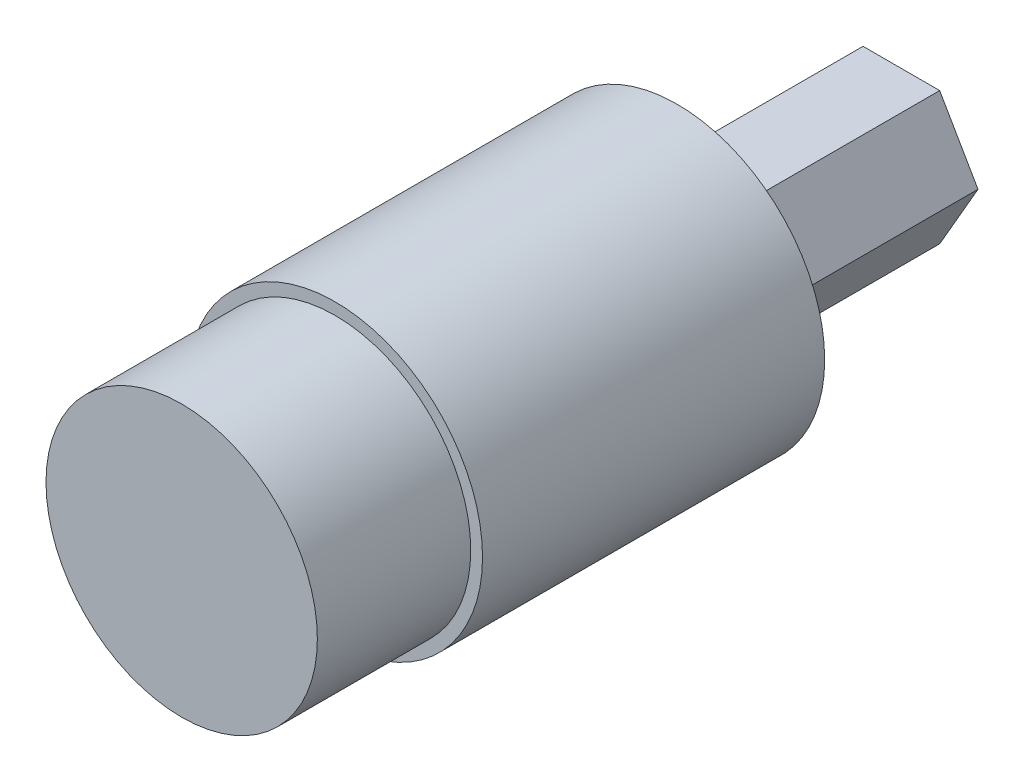
from build123d import *

# Parameters (mm, degrees)
SKETCH2_R           = 15.875
BOSS_EXTRUDE1_DEPTH = 53.34
SKETCH3_R           = 4.3053
BOSS_EXTRUDE2_DEPTH = 24.13
SKETCH4_R           = 3.175
BOSS_EXTRUDE3_DEPTH = 16.51
SKETCH5_OUTSIDE_W   = 51.704
SKETCH5_OUTSIDE_H   = 52.339
SKETCH5_OUTSIDE_R   = 14.605
CUT_EXTRUDE1_DEPTH  = 16.51


with BuildPart() as part:
    # Sketch2 → Boss-Extrude1 (new body)
    with BuildSketch(Plane.XY):
        Circle(SKETCH2_R)
    extrude(amount=BOSS_EXTRUDE1_DEPTH)

    # Sketch3 → Boss-Extrude2 (add)
    with BuildSketch(Plane(origin=(0, 0, 0), x_dir=(-1, 0, 0), z_dir=(0, 0, -1))):
        Polygon((8.248891971, 0), (4.124445986, 7.14375), (-4.124445986, 7.14375), (-8.248891971, 0), (-4.124445986, -7.14375), (4.124445986, -7.14375), align=None)
        Circle(SKETCH3_R, mode=Mode.SUBTRACT)
    extrude(amount=BOSS_EXTRUDE2_DEPTH)

    # Sketch4 → Boss-Extrude3 (add)
    with BuildSketch(Plane(origin=(0, 0, 0), x_dir=(1, 0, 0), z_dir=(0, 1, 0))):
        with Locations(Location((1.475733324, -26.436178991, 0), (0, 0, 270))):
            Circle(SKETCH4_R)
    extrude(amount=-BOSS_EXTRUDE3_DEPTH)

    # Sketch5 outside → Cut-Extrude1 (cut)
    with BuildSketch(Plane.XY.offset(53.34)):
        with Locations((0, -0.3175)):
            Rectangle(SKETCH5_OUTSIDE_W, SKETCH5_OUTSIDE_H)
        Circle(SKETCH5_OUTSIDE_R, mode=Mode.SUBTRACT)
    extrude(amount=-CUT_EXTRUDE1_DEPTH, mode=Mode.SUBTRACT)


solid = part.part
